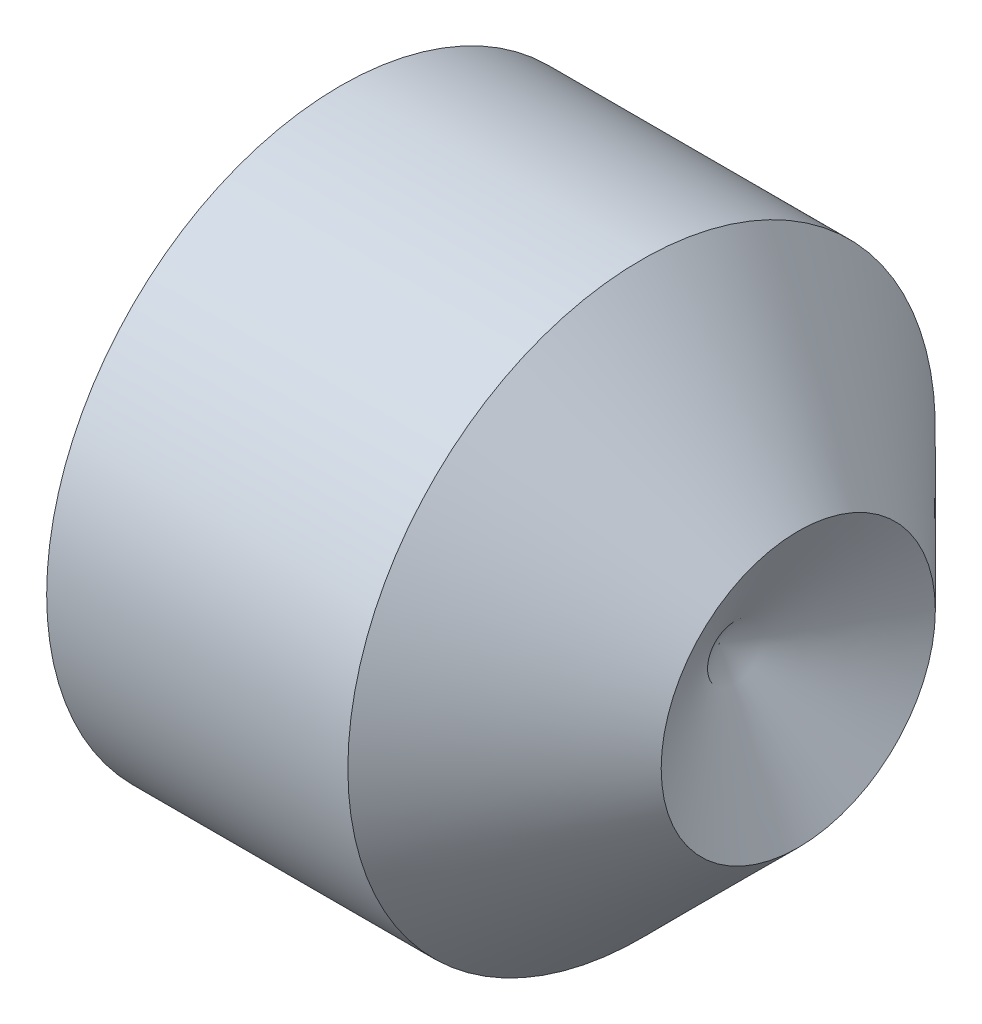
from build123d import *

# Parameters (mm, degrees)
HEX_2_DEPTH = 1.2


with BuildPart() as part:
    # BodySke → BaseBody (revolve)
    with BuildSketch(Plane.XY, mode=Mode.PRIVATE) as basebody_sk:
        Polygon((0, 0), (0, 1.2195), (0.161946751, 1.5), (1.7, 1.5), (2.5, 0.7), (2.095854812, 0), align=None)
    revolve(basebody_sk.sketch.rotate(Axis((-12.7, 0, 0), (1, 0, 0)), 90), axis=Axis((-12.7, 0, 0), (1, 0, 0)))

    # Sketch2 → Hex 2 (cut)
    with BuildSketch(Plane.ZY):
        Polygon((0.433012702, 0.75), (-0.433012702, 0.75), (-0.866025404, 0), (-0.433012702, -0.75), (0.433012702, -0.75), (0.866025404, 0), align=None)
    extrude(amount=-HEX_2_DEPTH, mode=Mode.SUBTRACT)


solid = part.part
